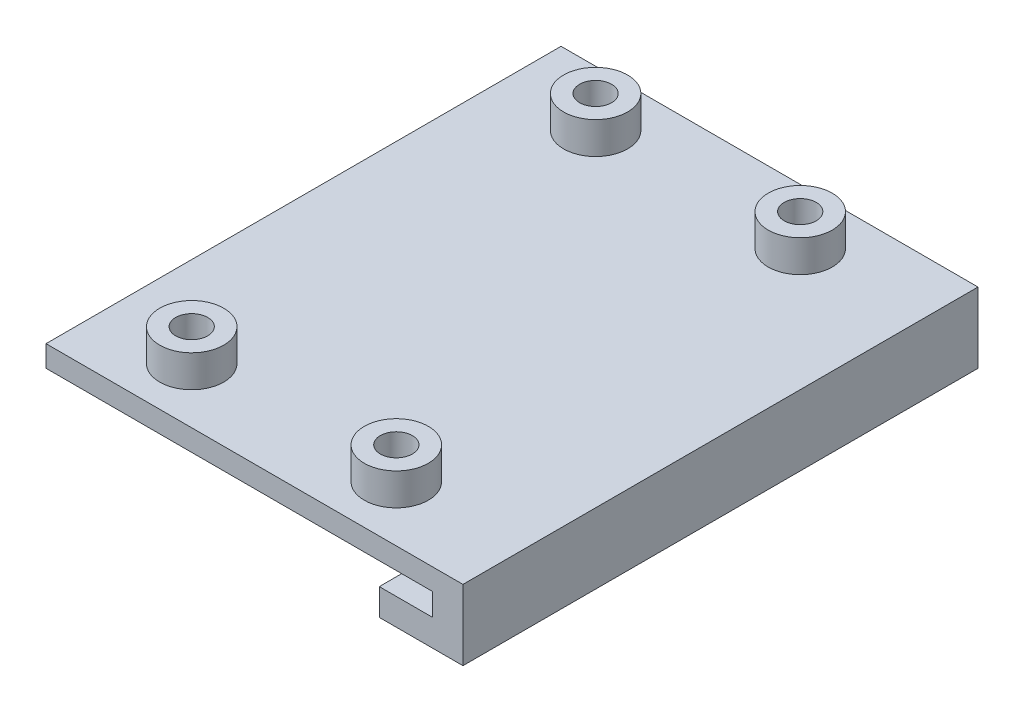
from build123d import *

# Parameters (mm, degrees)
ESQUISSE1_W             = 36.068
ESQUISSE1_H             = 48.26
BOSS_EXTRU_1_DEPTH      = 2
ESQUISSE4_R             = 3
BOSS_EXTRU_2_DEPTH      = 3
ESQUISSE6_R             = 1.5
ENL_V_MAT_EXTRU_1_DEPTH = 31.536569159
ESQUISSE10_W            = 48.26
ESQUISSE10_H            = 2
BOSS_EXTRU_3_DEPTH      = 3
ESQUISSE11_W            = 2.839594579
ESQUISSE11_H            = 48.26
BOSS_EXTRU_4_DEPTH      = 4.6
ESQUISSE12_W            = 48.26
ESQUISSE12_H            = 2.5
BOSS_EXTRU_5_DEPTH      = 5


with BuildPart() as part:
    # Esquisse1 → Boss.-Extru.1 (new body)
    with BuildSketch(Plane(origin=(0, 0, 0), x_dir=(1, 0, 0), z_dir=(0, 1, 0))):
        Rectangle(ESQUISSE1_W, ESQUISSE1_H)
    extrude(amount=BOSS_EXTRU_1_DEPTH)

    # Esquisse4 → Boss.-Extru.2 (add)
    with BuildSketch(Plane(origin=(0, 2, 0), x_dir=(1, 0, 0), z_dir=(0, 1, 0))):
        with Locations(Location((9.585669099, 18.921, 0), (0, 0, 270))):
            Circle(ESQUISSE4_R)
        with Locations(Location((9.585669099, -18.925, 0), (0, 0, 270))):
            Circle(ESQUISSE4_R)
    boss_extru_2 = extrude(amount=BOSS_EXTRU_2_DEPTH)

    # Esquisse6 → Enlèv. mat.-Extru.1 (cut, through all)
    with BuildSketch(Plane(origin=(0, 5, 0), x_dir=(1, 0, 0), z_dir=(0, 1, 0))):
        with Locations(Location((9.585669099, 18.921, 0), (0, 0, 270))):
            Circle(ESQUISSE6_R)
        with Locations(Location((9.585669099, -18.925, 0), (0, 0, 270))):
            Circle(ESQUISSE6_R)
    enl_v_mat_extru_1 = extrude(amount=-ENL_V_MAT_EXTRU_1_DEPTH, mode=Mode.SUBTRACT)

    # Symétrie1: Boss.-Extru.2, Enlèv. mat.-Extru.1 across plane
    add(boss_extru_2.mirror(Plane(origin=(0, 0, 0), x_dir=(0, 0, 1), z_dir=(1, 0, 0))))
    add(enl_v_mat_extru_1.mirror(Plane(origin=(0, 0, 0), x_dir=(0, 0, 1), z_dir=(1, 0, 0))), mode=Mode.SUBTRACT)

    # Esquisse10 → Boss.-Extru.3 (add)
    with BuildSketch(Plane(origin=(18.034, 0, 0), x_dir=(0, 0, -1), z_dir=(1, 0, 0))):
        with Locations((0, 1)):
            Rectangle(ESQUISSE10_W, ESQUISSE10_H)
    extrude(amount=BOSS_EXTRU_3_DEPTH)

    # Esquisse11 → Boss.-Extru.4 (add)
    with BuildSketch(Plane(origin=(0, 0, 0), x_dir=(-1, 0, 0), z_dir=(0, -1, 0))):
        with Locations((-19.614202711, 0)):
            Rectangle(ESQUISSE11_W, ESQUISSE11_H)
    extrude(amount=BOSS_EXTRU_4_DEPTH)

    # Esquisse12 → Boss.-Extru.5 (add)
    with BuildSketch(Plane.ZY.offset(-18.194405421)):
        with Locations((0, -3.35)):
            Rectangle(ESQUISSE12_W, ESQUISSE12_H)
    extrude(amount=BOSS_EXTRU_5_DEPTH)


solid = part.part
